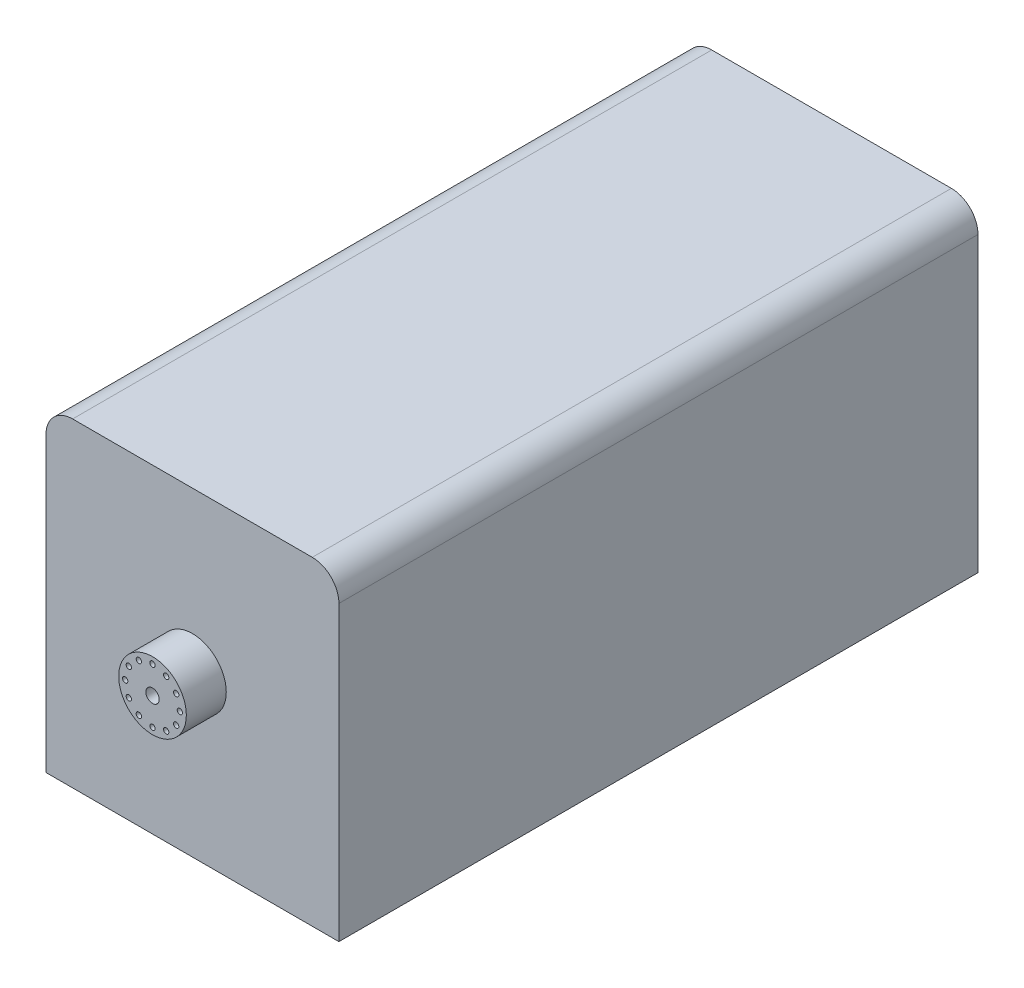
from build123d import *

# Parameters (mm, degrees)
SKETCH1_W           = 110
SKETCH1_H           = 120
BOSS_EXTRUDE1_DEPTH = 240
FILLET1_R           = 10
SKETCH2_R           = 7.5
BOSS_EXTRUDE2_DEPTH = 10
SKETCH3_R           = 12.7
SKETCH3_R_2         = 2.516719654
SKETCH3_R_3         = 1
BOSS_EXTRUDE3_DEPTH = 15


with BuildPart() as part:
    # Sketch1 → Boss-Extrude1 (new body)
    with BuildSketch(Plane.XY):
        Rectangle(SKETCH1_W, SKETCH1_H)
    extrude(amount=BOSS_EXTRUDE1_DEPTH)

    # Fillet1
    fillet1_edges = [part.edges().sort_by_distance(p)[0] for p in [
        (-55, 60, 120),
        (55, 60, 120),
    ]]
    fillet(fillet1_edges, radius=FILLET1_R)

    # Sketch2 → Boss-Extrude2 (add)
    with BuildSketch(Plane.XZ.offset(60)):
        with Locations(Location((-37.059126993, 221.569070344, 0), (0, 0, 180))):
            Circle(SKETCH2_R)
        with Locations(Location((32.940873007, 221.569070344, 0), (0, 0, 180))):
            Circle(SKETCH2_R)
        with Locations(Location((32.940873007, 21.569070344, 0), (0, 0, 180))):
            Circle(SKETCH2_R)
        with Locations(Location((-37.059126993, 21.569070344, 0), (0, 0, 180))):
            Circle(SKETCH2_R)
    extrude(amount=BOSS_EXTRUDE2_DEPTH)

    # Sketch3 → Boss-Extrude3 (add)
    with BuildSketch(Plane.XY.offset(240)):
        Circle(SKETCH3_R)
        Circle(SKETCH3_R_2, mode=Mode.SUBTRACT)
        with Locations((-10.265012075, 0)):
            Circle(SKETCH3_R_3, mode=Mode.SUBTRACT)
        with Locations((-8.889761227, 5.132506037)):
            Circle(SKETCH3_R_3, mode=Mode.SUBTRACT)
        with Locations((-5.132506037, 8.889761227)):
            Circle(SKETCH3_R_3, mode=Mode.SUBTRACT)
        with Locations((0, 10.265012075)):
            Circle(SKETCH3_R_3, mode=Mode.SUBTRACT)
        with Locations((5.132506037, 8.889761227)):
            Circle(SKETCH3_R_3, mode=Mode.SUBTRACT)
        with Locations((8.889761227, 5.132506037)):
            Circle(SKETCH3_R_3, mode=Mode.SUBTRACT)
        with Locations((10.265012075, 0)):
            Circle(SKETCH3_R_3, mode=Mode.SUBTRACT)
        with Locations((8.889761227, -5.132506037)):
            Circle(SKETCH3_R_3, mode=Mode.SUBTRACT)
        with Locations((5.132506037, -8.889761227)):
            Circle(SKETCH3_R_3, mode=Mode.SUBTRACT)
        with Locations((0, -10.265012075)):
            Circle(SKETCH3_R_3, mode=Mode.SUBTRACT)
        with Locations((-5.132506037, -8.889761227)):
            Circle(SKETCH3_R_3, mode=Mode.SUBTRACT)
        with Locations((-8.889761227, -5.132506037)):
            Circle(SKETCH3_R_3, mode=Mode.SUBTRACT)
    extrude(amount=BOSS_EXTRUDE3_DEPTH)


solid = part.part
